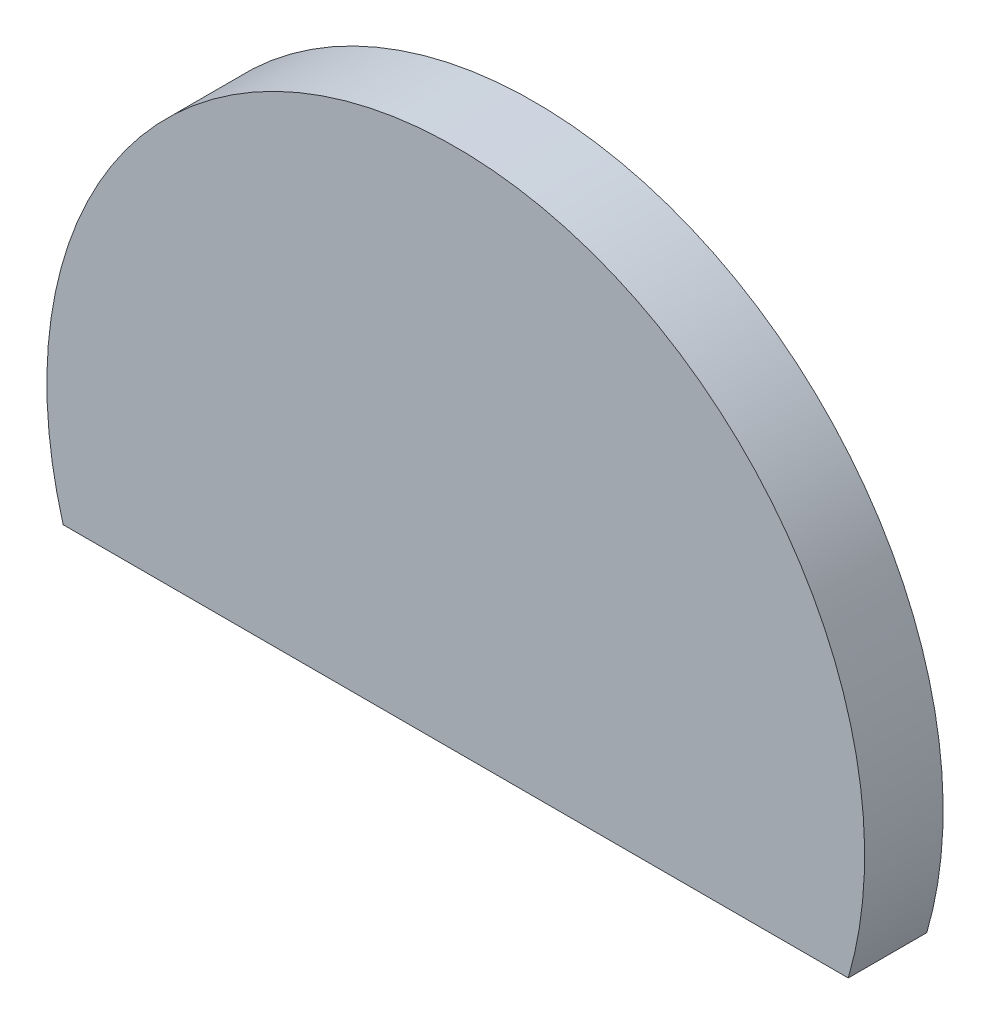
from build123d import *

# Parameters (mm, degrees)
BOSS_EXTRUDE1_DEPTH = 3


with BuildPart() as part:
    # Sketch1 → Boss-Extrude1 (new body)
    with BuildSketch(Plane.XY):
        with BuildLine():
            Line((15, 180), (0, 180))
            Line((0, 180), (0, 200))
            ThreePointArc((0, 200), (12.5, 193.75), (15, 180))
        make_face()
    boss_extrude1 = extrude(amount=BOSS_EXTRUDE1_DEPTH)

    # Mirror1: Boss-Extrude1 across plane
    add(boss_extrude1.mirror(Plane(origin=(0, 180, 3), x_dir=(0, 0, 1), z_dir=(1, 0, 0))))


solid = part.part
